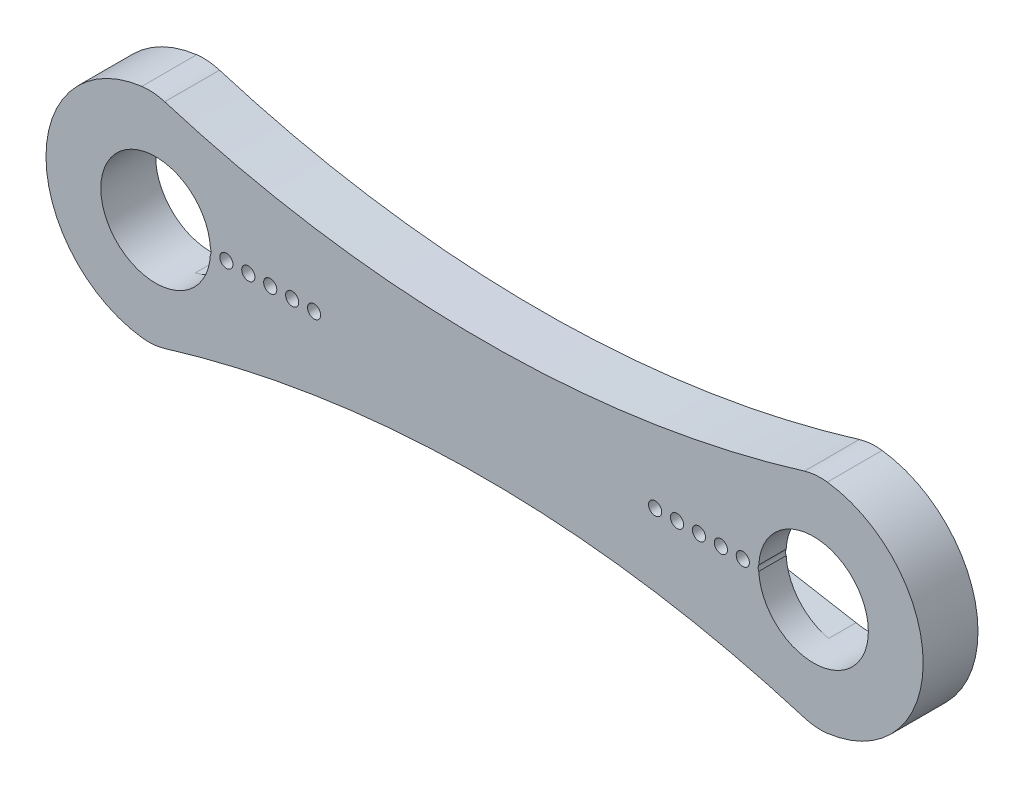
from build123d import *

# Parameters (mm, degrees)
SKETCH1_R           = 5
BOSS_EXTRUDE1_DEPTH = 5
FILLET1_R           = 5
SKETCH2_R           = 0.6
CUT_EXTRUDE1_DEPTH  = 5
SKETCH3_R           = 0.6
CUT_EXTRUDE2_DEPTH  = 2.5


with BuildPart() as part:
    # Sketch1 → Boss-Extrude1 (new body)
    with BuildSketch(Plane.XY):
        with BuildLine():
            ThreePointArc((0, 10), (-10, 0), (0, -10))
            ThreePointArc((0, -10), (30, -5.393920142), (60, -10))
            ThreePointArc((60, -10), (70, 0), (60, 10))
            ThreePointArc((60, 10), (30, 5.393920142), (0, 10))
        make_face()
        Circle(SKETCH1_R, mode=Mode.SUBTRACT)
        with Locations((60, 0)):
            Circle(SKETCH1_R, mode=Mode.SUBTRACT)
    extrude(amount=BOSS_EXTRUDE1_DEPTH)

    # Fillet1
    fillet1_edges = [part.edges().sort_by_distance(p)[0] for p in [
        (60, 10, 2.5),
        (60, -10, 2.5),
        (0, -10, 2.5),
        (0, 10, 2.5),
    ]]
    fillet(fillet1_edges, radius=FILLET1_R)

    # Sketch2 → Cut-Extrude1 (cut)
    with BuildSketch(Plane(origin=(0, 0, 0), x_dir=(-1, 0, 0), z_dir=(0, 0, -1))):
        with Locations((-4.45, 0)):
            Circle(SKETCH2_R)
        with Locations((-6.45, 0)):
            Circle(SKETCH2_R)
        with Locations((-8.45, 0)):
            Circle(SKETCH2_R)
        with Locations((-10.45, 0)):
            Circle(SKETCH2_R)
        with Locations((-12.45, 0)):
            Circle(SKETCH2_R)
        with Locations((-14.45, 0)):
            Circle(SKETCH2_R)
    cut_extrude1 = extrude(amount=-CUT_EXTRUDE1_DEPTH, mode=Mode.SUBTRACT)

    # Sketch3 → Cut-Extrude2 (cut)
    with BuildSketch(Plane(origin=(0, 0, 0), x_dir=(-1, 0, 0), z_dir=(0, 0, -1))):
        with BuildLine():
            Line((-15.012283737, -2.435946838), (-1.124567474, -4.871893677))
            ThreePointArc((-1.124567474, -4.871893677), (-3.832599709, -3.211102532), (-4.993539326, -0.254096441))
            ThreePointArc((-4.993539326, -0.254096441), (-5.05, 0), (-4.993539326, 0.254096441))
            ThreePointArc((-4.993539326, 0.254096441), (-3.746221254, 3.311468906), (-0.865051903, 4.924600005))
            Line((-0.865051903, 4.924600005), (-14.882525952, 2.462300002))
            ThreePointArc((-14.882525952, 2.462300002), (-16.949123268, 0.066203422), (-15.012283737, -2.435946838))
        make_face()
        with Locations((-12.45, 0)):
            Circle(SKETCH3_R, mode=Mode.SUBTRACT)
        with Locations((-6.45, 0)):
            Circle(SKETCH3_R, mode=Mode.SUBTRACT)
        with Locations((-8.45, 0)):
            Circle(SKETCH3_R, mode=Mode.SUBTRACT)
        with Locations((-10.45, 0)):
            Circle(SKETCH3_R, mode=Mode.SUBTRACT)
        with Locations((-14.45, 0)):
            Circle(SKETCH3_R, mode=Mode.SUBTRACT)
    cut_extrude2 = extrude(amount=-CUT_EXTRUDE2_DEPTH, mode=Mode.SUBTRACT)

    # Mirror2: Cut-Extrude1, Cut-Extrude2 across plane
    add(cut_extrude1.mirror(Plane(origin=(30, 0, 0), x_dir=(0, 0, 1), z_dir=(1, 0, 0))), mode=Mode.SUBTRACT)
    add(cut_extrude2.mirror(Plane(origin=(30, 0, 0), x_dir=(0, 0, 1), z_dir=(1, 0, 0))), mode=Mode.SUBTRACT)


solid = part.part
